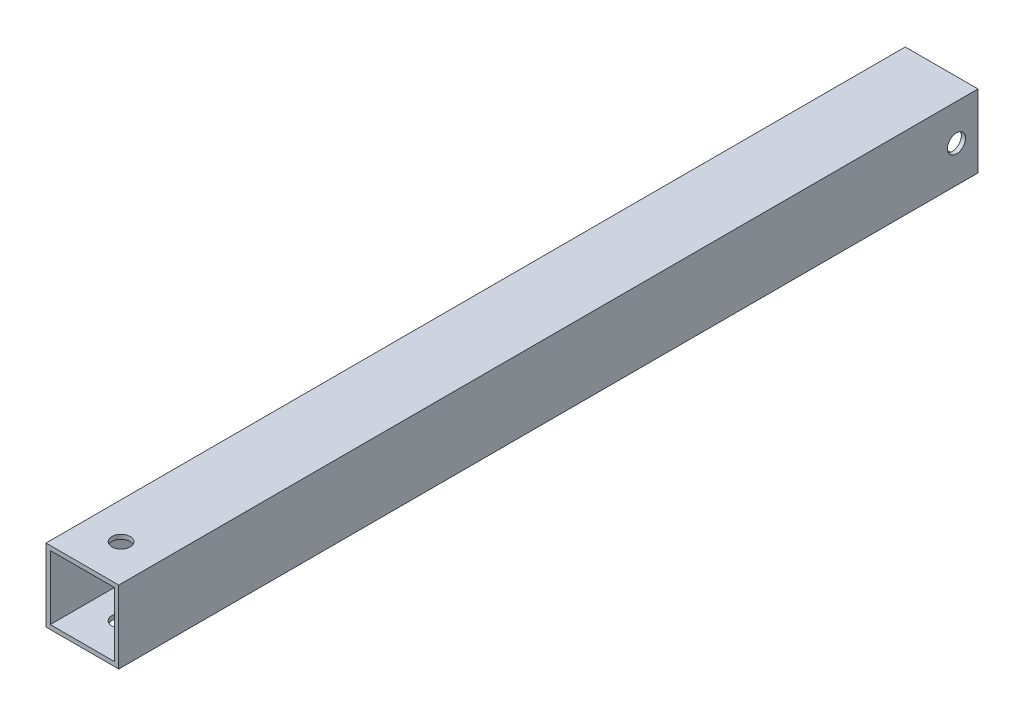
from build123d import *

# Parameters (mm, degrees)
CROQUIS1_W              = 50.8
CROQUIS1_H              = 50.8
CROQUIS1_W_2            = 44.8
CROQUIS1_H_2            = 44.8
SALIENTE_EXTRUIR1_DEPTH = 300
CROQUIS2_R              = 6.35
CORTAR_EXTRUIR1_DEPTH   = 306.32900288
CROQUIS3_R              = 6.35
CORTAR_EXTRUIR2_DEPTH   = 70


with BuildPart() as part:
    # Croquis1 → Saliente-Extruir1 (new, symmetric)
    with BuildSketch(Plane.XY):
        Rectangle(CROQUIS1_W, CROQUIS1_H)
        Rectangle(CROQUIS1_W_2, CROQUIS1_H_2, mode=Mode.SUBTRACT)
    extrude(amount=SALIENTE_EXTRUIR1_DEPTH, both=True)

    # Croquis2 → Cortar-Extruir1 (cut, through all)
    with BuildSketch(Plane(origin=(25.4, 0, 0), x_dir=(0, 0, -1), z_dir=(1, 0, 0))):
        with Locations(Location((285, 0, 0), (0, 0, 270))):
            Circle(CROQUIS2_R)
    extrude(amount=-CORTAR_EXTRUIR1_DEPTH, mode=Mode.SUBTRACT)

    # Croquis3 → Cortar-Extruir2 (cut)
    with BuildSketch(Plane(origin=(0, 25.4, 0), x_dir=(1, 0, 0), z_dir=(0, 1, 0))):
        with Locations(Location((0, -273, 0), (0, 0, 270))):
            Circle(CROQUIS3_R)
    extrude(amount=-CORTAR_EXTRUIR2_DEPTH, mode=Mode.SUBTRACT)


solid = part.part
